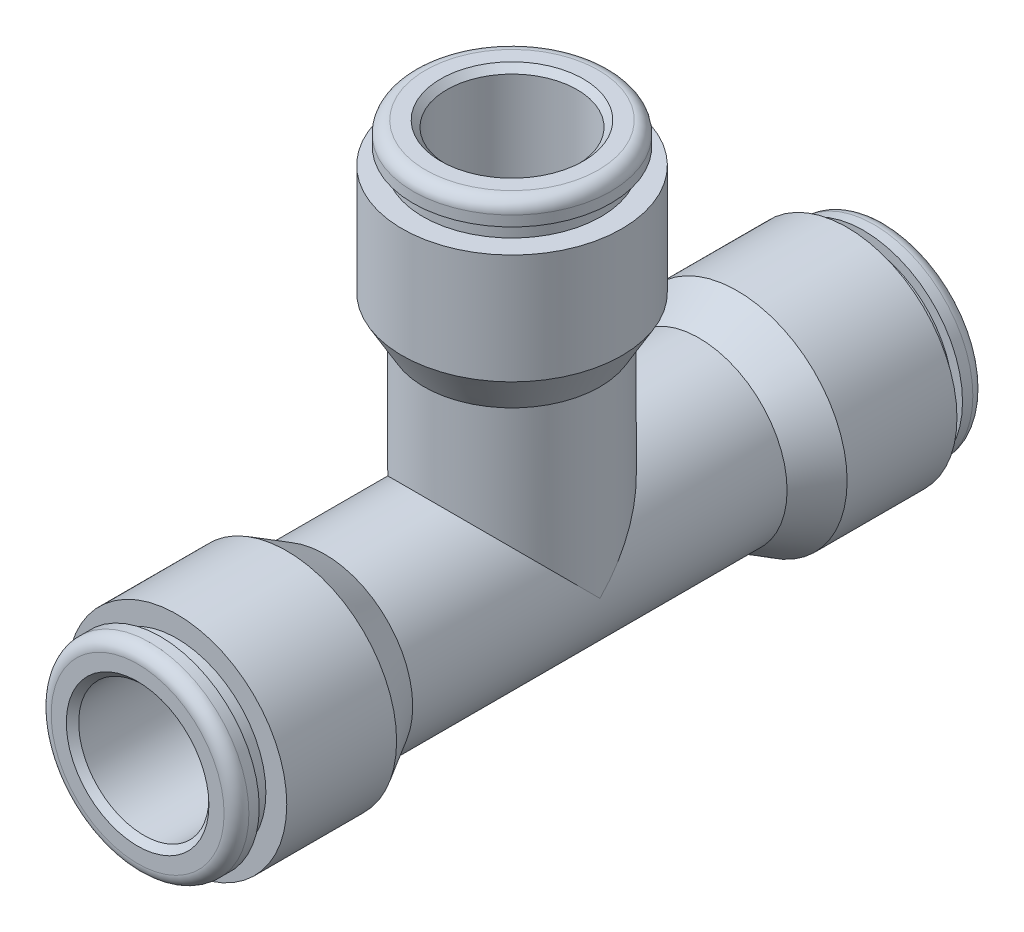
from build123d import *
from build123d.topology import SkipClean

# Parameters (mm, degrees)
CIRPATTERN1_COUNT            = 3
CIRPATTERN1_ANGLE            = 180
SKETCH3_R                    = 5.4
CUT_EXTRUDE2_DEPTH           = 34.047314566
CUT_EXTRUDE2_OTHER_WAY_DEPTH = 0.1
CUT_EXTRUDE2_OTHER_WAY_TAPER = 45
CIRPATTERN2_COUNT            = 2
CIRPATTERN2_ANGLE            = 180


with BuildPart() as part:
    # Sketch1 → Revolve1 (revolve)
    with BuildSketch(Plane(origin=(0, 0, 0), x_dir=(0, 0, -1), z_dir=(1, 0, 0)), mode=Mode.PRIVATE) as revolve1_sk:
        with BuildLine():
            Line((21.603, 6.075), (22.238, 6.075))
            ThreePointArc((22.238, 6.075), (22.776815367, 5.851815367), (23, 5.313))
            Line((23, 5.313), (23, 4.381))
            Line((23, 4.381), (22.619, 4))
            Line((22.619, 4), (6.9, 4))
            Line((6.9, 4), (6.9, 3.238))
            Line((6.9, 3.238), (0, 3.238))
            Line((0, 3.238), (0, 5.4))
            Line((0, 5.4), (11.5, 5.4))
            Line((11.5, 5.4), (13.83826859, 6.75))
            Line((13.83826859, 6.75), (20.587, 6.75))
            Line((20.587, 6.75), (20.587, 5.4675))
            Line((20.587, 5.4675), (21.603, 5.4675))
            Line((21.603, 5.4675), (21.603, 6.075))
        make_face()
    revolve(revolve1_sk.sketch.rotate(Axis((0, 0, 0), (0, 0, -1)), 90), axis=Axis((0, 0, 0), (0, 0, -1)))


with BuildPart() as cirpattern1_1:
    # CirPattern1: pattern copy
    add(part.part.rotate(Axis((0, 0, 0), (1, 0, 0)), 1 * CIRPATTERN1_ANGLE / (CIRPATTERN1_COUNT - 1)))


with BuildPart() as cirpattern1_2:
    # CirPattern1: pattern copy
    add(part.part.rotate(Axis((0, 0, 0), (1, 0, 0)), 2 * CIRPATTERN1_ANGLE / (CIRPATTERN1_COUNT - 1)))


with BuildPart() as cirpattern1_1_1:
    # Body-Move/Copy1: moved
    add(cirpattern1_1.part.moved(Location((0, -0.25, 0))))

    # Sketch3 → Cut-Extrude2 (cut)
    with BuildSketch(Plane(origin=(0, 0, 0), x_dir=(1, 0, 0), z_dir=(0, 1, 0))):
        Circle(SKETCH3_R)
    extrude(amount=-CUT_EXTRUDE2_DEPTH, mode=Mode.SUBTRACT)

    # Sketch3 → Cut-Extrude2 other way (cut)
    with BuildSketch(Plane(origin=(0, 0, 0), x_dir=(1, 0, 0), z_dir=(0, 1, 0))):
        Circle(SKETCH3_R)
    extrude(amount=CUT_EXTRUDE2_OTHER_WAY_DEPTH, taper=CUT_EXTRUDE2_OTHER_WAY_TAPER, mode=Mode.SUBTRACT)


with BuildPart() as cut_revolve2_tool:
    # Sketch4 → Cut-Revolve2 (revolve)
    with BuildSketch(Plane(origin=(0, 0, 0), x_dir=(0, 0, -1), z_dir=(1, 0, 0))):
        Polygon((4, 22.369), (4.381, 22.75), (0, 22.75), (0, 0), (3.238, 0), (3.238, 6.65), (4, 6.65), align=None)
    revolve(axis=Axis((0, 0, 0), (0, 1, 0)))


with BuildPart() as part_1:
    add(part.part)

    # Cut-Revolve2: cut by cut_revolve2_tool
    add(cut_revolve2_tool.part, mode=Mode.SUBTRACT)


with BuildPart() as cirpattern1_2_1:
    add(cirpattern1_2.part)

    # Cut-Revolve2: cut by cut_revolve2_tool
    add(cut_revolve2_tool.part, mode=Mode.SUBTRACT)


with BuildPart() as part_2:
    add(part_1.part)

    # Combine1: union CirPattern1_1, CirPattern1_2
    add(cirpattern1_1_1.part)
    add(cirpattern1_2_1.part)

    # Sketch5 → Cut-Revolve1 (revolve, cut)
    with BuildSketch(Plane(origin=(0, 0, 0), x_dir=(0, 0, -1), z_dir=(1, 0, 0)), mode=Mode.PRIVATE) as cut_revolve1_sk:
        Polygon((23, 4.381), (22.619, 4), (6.9, 4), (6.9, 3.238), (0, 3.238), (0, 0), (23, 0), align=None)
    cut_revolve1 = revolve(cut_revolve1_sk.sketch.rotate(Axis((0, 0, 0), (0, 0, -1)), 90), axis=Axis((0, 0, 0), (0, 0, -1)), mode=Mode.SUBTRACT)

    # CirPattern2: Cut-Revolve1 ×2 about axis
    cirpattern2_axis = Axis((-6.05, 0, 0), (1, 0, 0))
    for i in range(1, CIRPATTERN2_COUNT):
        add(cut_revolve1.rotate(cirpattern2_axis, i * CIRPATTERN2_ANGLE / (CIRPATTERN2_COUNT - 1)), mode=Mode.SUBTRACT)


solid = part_2.part
